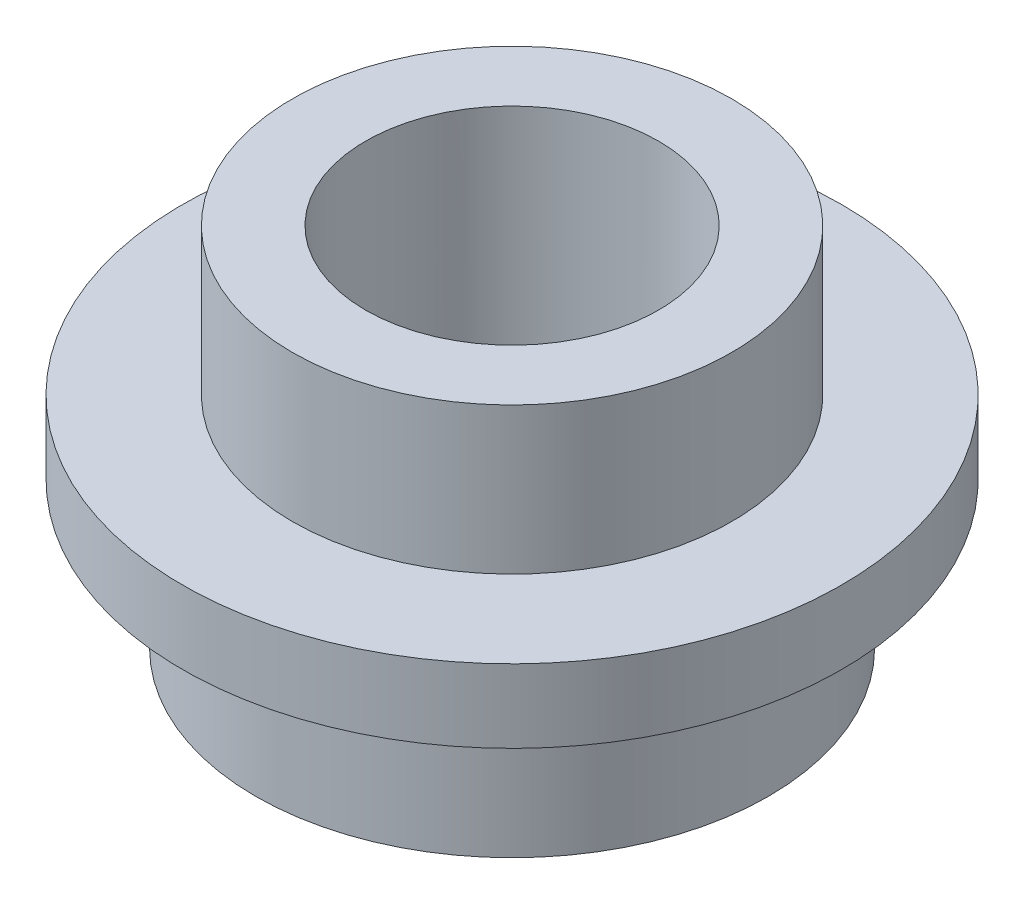
from build123d import *
from build123d.topology import SkipClean

# Parameters (mm, degrees)
SKETCH1_R    = 19.05
SKETCH1_R_2  = 12.7
TOP_DEPTH    = 12.7
MIDDLE_START = 6.35
SKETCH4_R    = 28.575
SKETCH4_R_2  = 12.7
MIDDLE_DEPTH = 6.35
SKETCH5_R    = 22.225
SKETCH5_R_2  = 15.875
BOTTOM_DEPTH = 12.7


with BuildPart() as part:
    # Sketch1 → Top (new body)
    with BuildSketch(Plane(origin=(0, 0, 0), x_dir=(1, 0, 0), z_dir=(0, 1, 0))):
        with Locations(Location((0, 0, 0), (0, 0, 270))):
            Circle(SKETCH1_R)
        with Locations(Location((0, 0, 0), (0, 0, 270))):
            Circle(SKETCH1_R_2, mode=Mode.SUBTRACT)
    extrude(amount=TOP_DEPTH)

    # Sketch4 → Middle (add)
    with SkipClean():  # the faces are left unmerged after this step: merging them gives an invalid solid
        with BuildSketch(Plane.XZ.offset(MIDDLE_START)):
            with Locations(Location((0, 0, 0), (0, 0, 270))):
                Circle(SKETCH4_R)
            with Locations(Location((0, 0, 0), (0, 0, 270))):
                Circle(SKETCH4_R_2, mode=Mode.SUBTRACT)
        extrude(amount=-MIDDLE_DEPTH)

    # Sketch5 → Bottom (add)
    with SkipClean():  # the faces are left unmerged after this step: merging them gives an invalid solid
        with BuildSketch(Plane.XZ.offset(6.35)):
            with Locations(Location((0, 0, 0), (0, 0, 270))):
                Circle(SKETCH5_R)
            with Locations(Location((0, 0, 0), (0, 0, 270))):
                Circle(SKETCH5_R_2, mode=Mode.SUBTRACT)
        extrude(amount=BOTTOM_DEPTH)


solid = part.part
